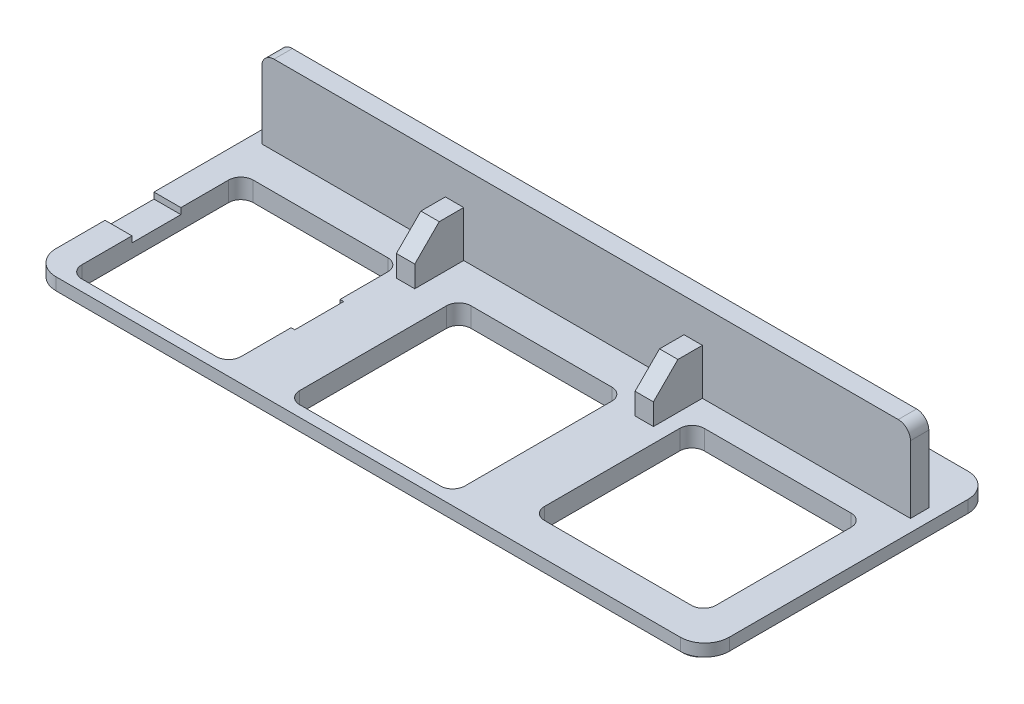
from build123d import *

# Parameters (mm, degrees)
SKETCH_1_W          = 55
SKETCH_1_H          = 23.5
EXTRUDE_1_DEPTH     = 1
FILLET_1_R          = 2
SKETCH_2_W          = 53.2
SKETCH_2_H          = 22.3
EXTRUDE_2_DEPTH     = 0.6
SKETCH_3_W          = 13
SKETCH_3_H          = 14
SKETCH_3_W_2        = 13.5
SKETCH_3_W_3        = 14
SKETCH_3_H_2        = 13.05
CUT_EXTRUDE_1_DEPTH = 3
FILLET_2_R          = 1
SKETCH_4_W          = 15.5
SKETCH_4_H          = 3.997435945
CUT_EXTRUDE_2_DEPTH = 0.5
SKETCH_5_W          = 53
SKETCH_5_H          = 1.5
EXTRUDE_3_DEPTH     = 6.5
FILLET_3_R          = 1
SKETCH_6_W          = 1.5
SKETCH_6_H          = 4
EXTRUDE_4_DEPTH     = 3.75
CHAMFER_1_SIZE      = 2
FILLET_4_R          = 1.5


with BuildPart() as part:
    # 草图1 → 凸台-拉伸1 (new body)
    with BuildSketch(Plane(origin=(0, 0, 0), x_dir=(1, 0, 0), z_dir=(0, 1, 0))):
        Rectangle(SKETCH_1_W, SKETCH_1_H)
    extrude(amount=EXTRUDE_1_DEPTH)

    # 圆角1
    fillet_1_edges = [part.edges().sort_by_distance(p)[0] for p in [
        (27.5, 0.5, 11.75),
        (-27.5, 0.5, 11.75),
        (-27.5, 0.5, -11.75),
        (27.5, 0.5, -11.75),
    ]]
    fillet(fillet_1_edges, radius=FILLET_1_R)

    # 草图2 → 凸台-拉伸2 (add)
    with BuildSketch(Plane.XZ):
        Rectangle(SKETCH_2_W, SKETCH_2_H)
    extrude(amount=EXTRUDE_2_DEPTH)

    # 草图3 → 切除-拉伸1 (cut)
    with BuildSketch(Plane.XZ.offset(0.6)):
        with Locations((-18.8, 3.85)):
            Rectangle(SKETCH_3_W, SKETCH_3_H)
        with Locations((-0.75, 3.85)):
            Rectangle(SKETCH_3_W_2, SKETCH_3_H)
        with Locations((17.7, 2.516421356)):
            Rectangle(SKETCH_3_W_3, SKETCH_3_H_2)
    extrude(amount=-CUT_EXTRUDE_1_DEPTH, mode=Mode.SUBTRACT)

    # 圆角2
    fillet_2_edges = [part.edges().sort_by_distance(p)[0] for p in [
        (-25.3, 0.2, -3.15),
        (-25.3, 0.2, 10.85),
        (-12.3, 0.2, 10.85),
        (-12.3, 0.2, -3.15),
        (-7.5, 0.2, -3.15),
        (-7.5, 0.2, 10.85),
        (6, 0.2, 10.85),
        (6, 0.2, -3.15),
        (10.7, 0.2, -4.008578644),
        (10.7, 0.2, 9.041421356),
        (24.7, 0.2, 9.041421356),
        (24.7, 0.2, -4.008578644),
    ]]
    fillet(fillet_2_edges, radius=FILLET_2_R)

    # 草图4 → 切除-拉伸2 (cut)
    with BuildSketch(Plane(origin=(0, 1, 0), x_dir=(1, 0, 0), z_dir=(0, 1, 0))):
        with Locations((-19.75, -3.751282028)):
            Rectangle(SKETCH_4_W, SKETCH_4_H)
    extrude(amount=-CUT_EXTRUDE_2_DEPTH, mode=Mode.SUBTRACT)

    # 草图5 → 凸台-拉伸3 (add)
    with BuildSketch(Plane(origin=(0, 1, 0), x_dir=(1, 0, 0), z_dir=(0, 1, 0))):
        with Locations((0, 6.804632487)):
            Rectangle(SKETCH_5_W, SKETCH_5_H)
    extrude(amount=EXTRUDE_3_DEPTH)

    # 圆角3
    fillet_3_edges = [part.edges().sort_by_distance(p)[0] for p in [
        (26.5, 7.5, -6.804632487),
        (-26.5, 7.5, -6.804632487),
    ]]
    fillet(fillet_3_edges, radius=FILLET_3_R)

    # 草图6 → 凸台-拉伸4 (add)
    with BuildSketch(Plane(origin=(0, 1, 0), x_dir=(1, 0, 0), z_dir=(0, 1, 0))):
        with Locations((8.75, 4.054632487)):
            Rectangle(SKETCH_6_W, SKETCH_6_H)
        with Locations((-10.75, 4.054632487)):
            Rectangle(SKETCH_6_W, SKETCH_6_H)
    extrude(amount=EXTRUDE_4_DEPTH)

    # 倒角1
    chamfer_1_edges = [part.edges().sort_by_distance(p)[0] for p in [
        (8.75, 4.75, -2.054632487),
        (-10.75, 4.75, -2.054632487),
    ]]
    chamfer(chamfer_1_edges, length=CHAMFER_1_SIZE)

    # 圆角4
    fillet_4_edges = [part.edges().sort_by_distance(p)[0] for p in [
        (-26.6, -0.3, 11.15),
        (-26.6, -0.3, -11.15),
        (26.6, -0.3, -11.15),
        (26.6, -0.3, 11.15),
    ]]
    fillet(fillet_4_edges, radius=FILLET_4_R)


solid = part.part
